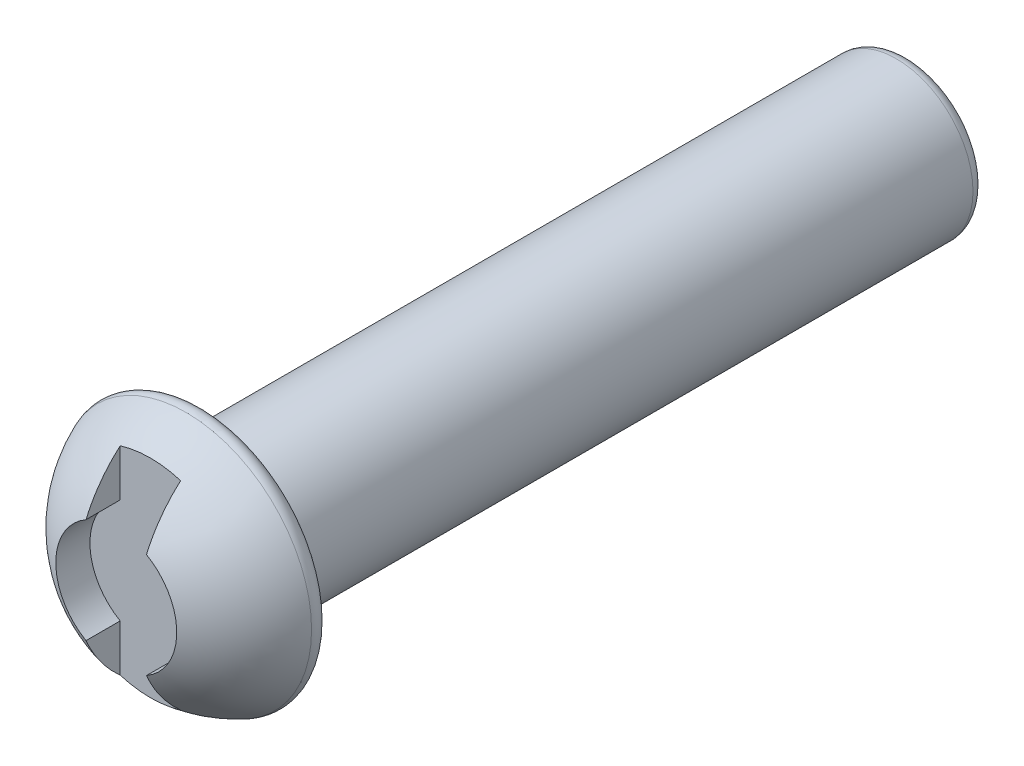
from build123d import *

# Parameters (mm, degrees)
CUT_EXTRUDE1_DEPTH = 0.6
FILLET1_R          = 0.15


with BuildPart() as part:
    # Sketch1 → Revolve1 (revolve)
    with BuildSketch(Plane(origin=(0, 0, 0), x_dir=(0, 0, -1), z_dir=(1, 0, 0))):
        with BuildLine():
            Line((0, 0), (10, 0))
            Line((10, 0), (10, 0.95))
            Line((10, 0.95), (1.25, 0.95))
            Line((1.25, 0.95), (1.25, 1.625))
            ThreePointArc((1.25, 1.625), (0.348650918, 1.025076217), (0, 0))
        make_face()
    revolve(axis=Axis((0, 0, 0), (0, 0, -1)))

    # Sketch2 → Cut-Extrude1 (cut)
    with BuildSketch(Plane.XY):
        with BuildLine():
            Line((-0.375, -0.649519053), (-0.375, -1.80863887))
            Line((-0.375, -1.80863887), (0.375, -1.80863887))
            Line((0.375, -1.80863887), (0.375, -0.649519053))
            ThreePointArc((0.375, -0.649519053), (0.75, 0), (0.375, 0.649519053))
            Line((0.375, 0.649519053), (0.375, 1.80863887))
            Line((0.375, 1.80863887), (-0.375, 1.80863887))
            Line((-0.375, 1.80863887), (-0.375, 0.649519053))
            ThreePointArc((-0.375, 0.649519053), (-0.75, 0), (-0.375, -0.649519053))
        make_face()
    extrude(amount=-CUT_EXTRUDE1_DEPTH, mode=Mode.SUBTRACT)

    # Fillet1
    fillet1_edges = [part.edges().sort_by_distance(p)[0] for p in [
        (0, -1.625, -1.25),
        (0, -0.95, -10),
    ]]
    fillet(fillet1_edges, radius=FILLET1_R)


solid = part.part
